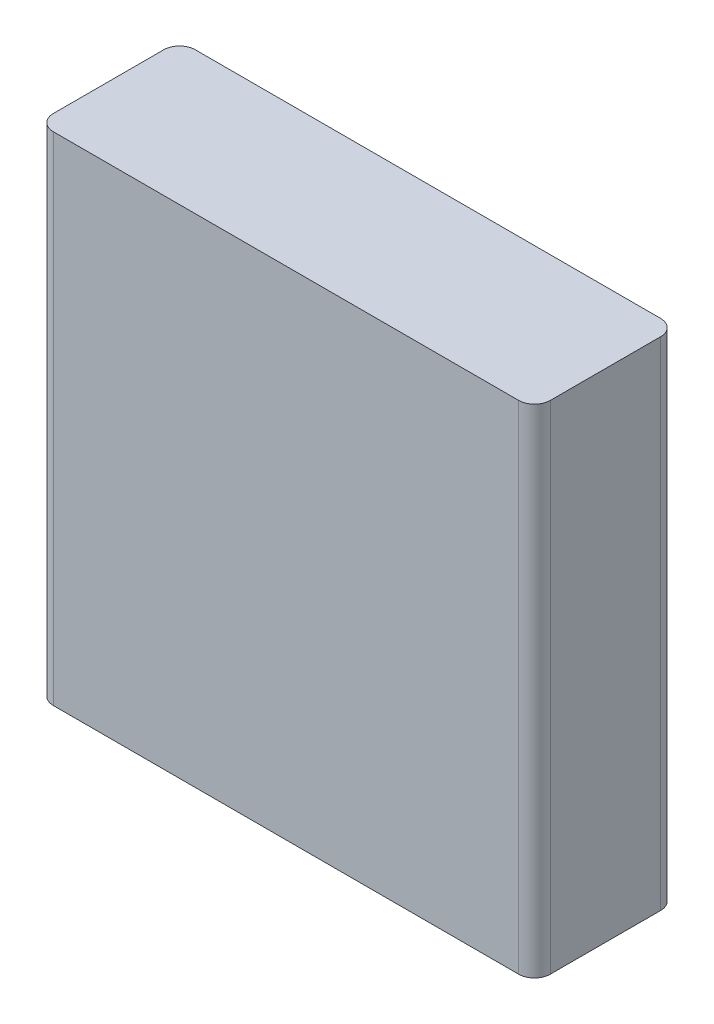
from build123d import *

# Parameters (mm, degrees)
SKETCH_1_W         = 63
SKETCH_1_H         = 63
BLOCKEXTRUDE_DEPTH = 18
FILLET_2_R         = 2


with BuildPart() as part:
    # 草图1 → BlockExtrude (new body)
    with BuildSketch(Plane.XY):
        with Locations((31.5, 31.5)):
            Rectangle(SKETCH_1_W, SKETCH_1_H)
    extrude(amount=BLOCKEXTRUDE_DEPTH)

    # Fillet 2
    fillet_2_edges = [part.edges().sort_by_distance(p)[0] for p in [
        (63, 31.5, 18),
        (0, 31.5, 18),
        (63, 31.5, 0),
        (0, 31.5, 0),
    ]]
    fillet(fillet_2_edges, radius=FILLET_2_R)


solid = part.part
